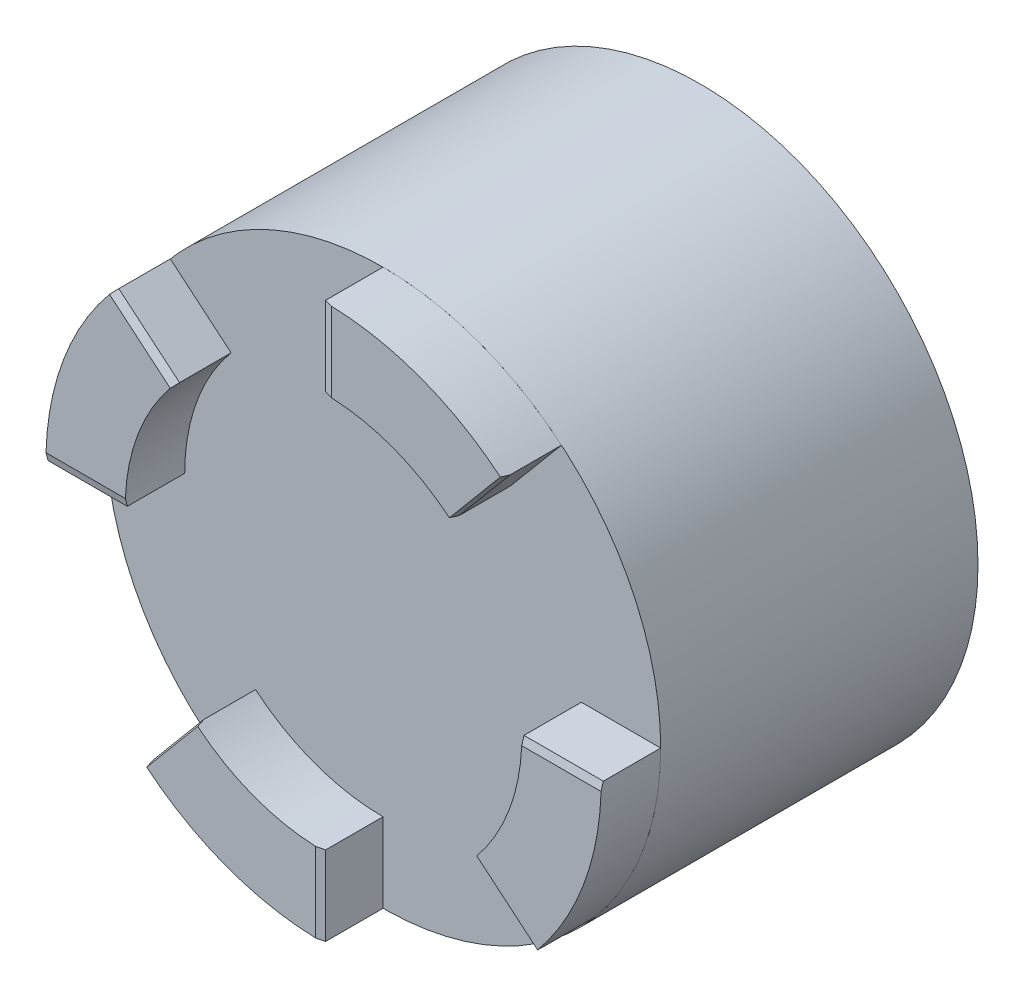
from build123d import *
from OCP.BRepFilletAPI import BRepFilletAPI_MakeChamfer

# Parameters (mm, degrees)
SKETCH1_R           = 7
BOSS_EXTRUDE1_DEPTH = 8
BOSS_EXTRUDE2_DEPTH = 1.5
CHAMFER2_SIZE       = 0.2
CHAMFER2_SIZE2      = 0.053589838
CIRPATTERN1_COUNT   = 4
SKETCH11_W          = 4.1
SKETCH11_H          = 4.1
CUT_EXTRUDE1_DEPTH  = 6
FILLET2_R           = 0.4


with BuildPart() as part:
    # Sketch1 → Boss-Extrude1 (new body)
    with BuildSketch(Plane.XY):
        Circle(SKETCH1_R)
    extrude(amount=BOSS_EXTRUDE1_DEPTH)

    # Sketch11 → Cut-Extrude1 (cut)
    with BuildSketch(Plane(origin=(0, 0, 0), x_dir=(-1, 0, 0), z_dir=(0, 0, -1))):
        Rectangle(SKETCH11_W, SKETCH11_H)
    extrude(amount=-CUT_EXTRUDE1_DEPTH, mode=Mode.SUBTRACT)

    # Fillet2
    fillet2_edges = [part.edges().sort_by_distance(p)[0] for p in [
        (0, -2.05, 0),
        (-2.05, 0, 0),
        (0, 2.05, 0),
        (2.05, 0, 0),
    ]]
    fillet(fillet2_edges, radius=FILLET2_R)


with BuildPart() as body_2:
    # Sketch2 → Boss-Extrude2 (new body)
    with BuildSketch(Plane.XY.offset(8)):
        with BuildLine():
            Line((0, 7), (0, 5))
            ThreePointArc((0, 5), (0.348782369, 4.987820251), (0.695865505, 4.951340344))
            Line((0.695865505, 4.951340344), (0.974211707, 6.931876481))
            ThreePointArc((0.974211707, 6.931876481), (0.488295316, 6.982948352), (0, 7))
        make_face()
        with BuildLine():
            Line((0.974211707, 6.931876481), (0.695865505, 4.951340344))
            ThreePointArc((0.695865505, 4.951340344), (2.033683215, 4.567727288), (3.213938048, 3.830222216))
            Line((3.213938048, 3.830222216), (4.499513268, 5.362311102))
            ThreePointArc((4.499513268, 5.362311102), (2.847156502, 6.394818203), (0.974211707, 6.931876481))
        make_face()
    extrude(amount=BOSS_EXTRUDE2_DEPTH)

    # Chamfer2: one chamfer whose edges measure the first distance from different faces: ONE call of the kernel's chamfer builder (chamfer() names one face for all edges)
    chamfer2_edges_1 = [body_2.edges().sort_by_distance(p)[0] for p in [
        (3.856725658, 4.596266659, 9.5),
    ]]
    chamfer2_side_1 = [body_2.faces().sort_by_distance(p)[0] for p in [
        (3.856725658, 4.596266659, 8.75),
    ]]
    chamfer2_edges_2 = [body_2.edges().sort_by_distance(p)[0] for p in [
        (0, 6, 9.5),
    ]]
    chamfer2_side_2 = [body_2.faces().sort_by_distance(p)[0] for p in [
        (2.029317492, 5.575503986, 9.5),
    ]]
    chamfer2 = BRepFilletAPI_MakeChamfer(body_2.part.solid().wrapped)
    for e in chamfer2_edges_1:
        chamfer2.Add(CHAMFER2_SIZE, CHAMFER2_SIZE2, e.wrapped, chamfer2_side_1[0].wrapped)  # the first distance lies on this face
    for e in chamfer2_edges_2:
        chamfer2.Add(CHAMFER2_SIZE, CHAMFER2_SIZE2, e.wrapped, chamfer2_side_2[0].wrapped)  # the first distance lies on this face
    add(Compound.cast(chamfer2.Shape()), mode=Mode.REPLACE)


with BuildPart() as cirpattern1_1:
    # CirPattern1: pattern copy
    add(body_2.part.rotate(Axis((0, 0, 0), (0, 0, 1)), 1 * 360 / CIRPATTERN1_COUNT))


with BuildPart() as cirpattern1_2:
    # CirPattern1: pattern copy
    add(body_2.part.rotate(Axis((0, 0, 0), (0, 0, 1)), 2 * 360 / CIRPATTERN1_COUNT))


with BuildPart() as cirpattern1_3:
    # CirPattern1: pattern copy
    add(body_2.part.rotate(Axis((0, 0, 0), (0, 0, 1)), 3 * 360 / CIRPATTERN1_COUNT))


solid = Compound([part.part, body_2.part, cirpattern1_1.part, cirpattern1_2.part, cirpattern1_3.part])
